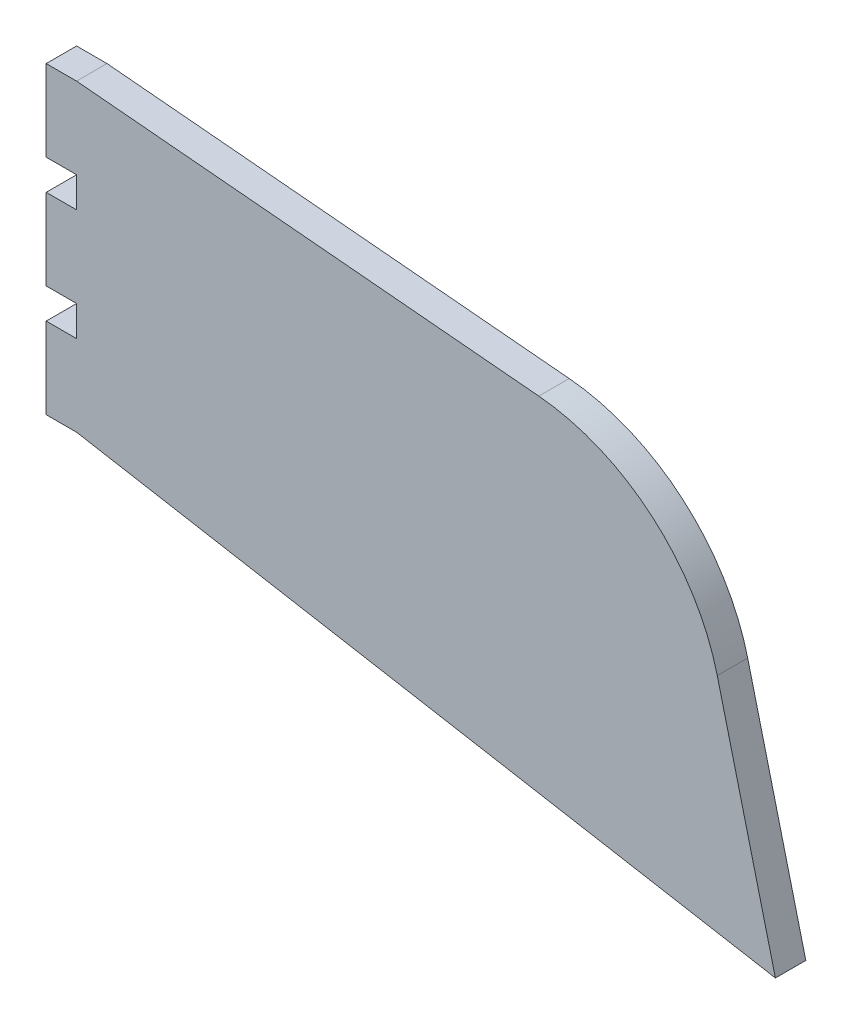
from build123d import *

# Parameters (mm, degrees)
ESQUISSE1_W        = 3
ESQUISSE1_H        = 8
BOSS_EXTRU_1_DEPTH = 3
CONG_1_R           = 20


with BuildPart() as part:
    # Esquisse1 → Boss.-Extru.1 (new body)
    with BuildSketch(Plane.XY):
        Polygon((-68.936542711, 42.155372437), (-9.179039763, 36.766416935), (0, 0), (-68.936542711, 12.155372437), align=None)
        with Locations((-70.436542711, 38.155372437)):
            Rectangle(ESQUISSE1_W, ESQUISSE1_H)
        with Locations((-70.436542711, 27.155372437)):
            Rectangle(ESQUISSE1_W, ESQUISSE1_H)
        with Locations((-70.436542711, 16.155372437)):
            Rectangle(ESQUISSE1_W, ESQUISSE1_H)
    extrude(amount=BOSS_EXTRU_1_DEPTH)

    # Congé1
    cong_1_edges = [part.edges().sort_by_distance(p)[0] for p in [
        (-9.179039763, 36.766416935, 1.5),
    ]]
    fillet(cong_1_edges, radius=CONG_1_R)


solid = part.part
